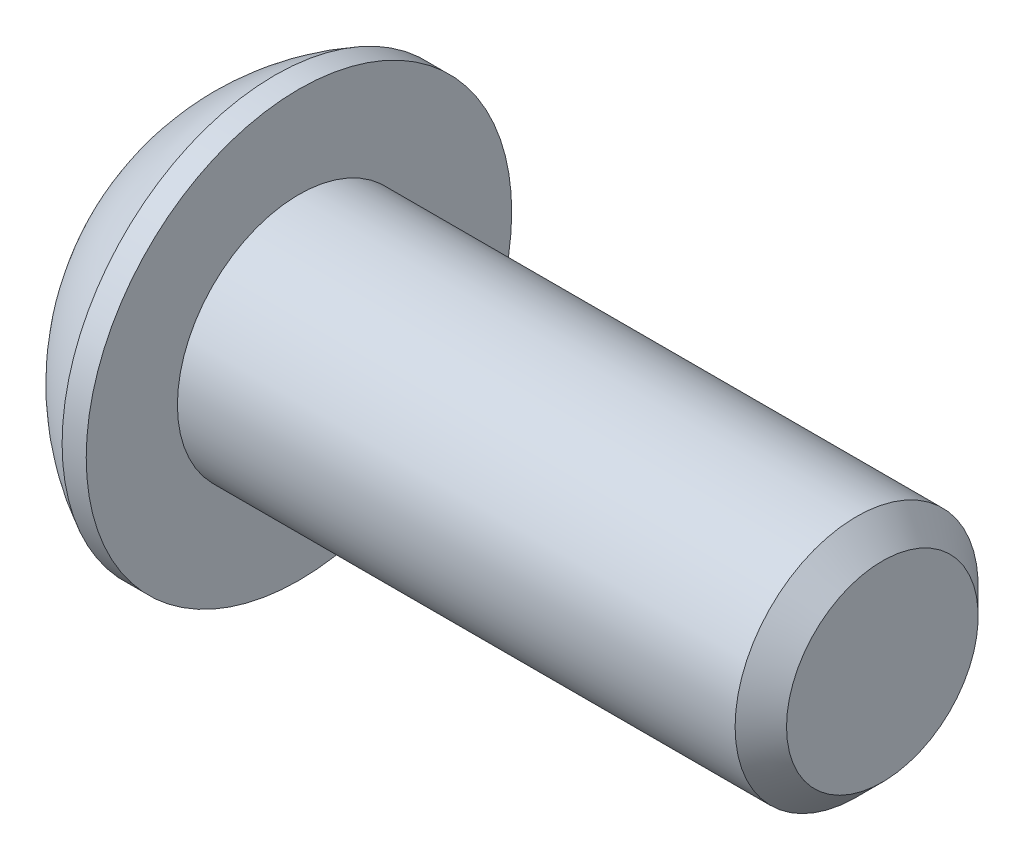
from build123d import *

# Parameters (mm, degrees)
HEX_2_DEPTH = 2.667


with BuildPart() as part:
    # BodySke → BaseBody (revolve)
    with BuildSketch(Plane.XY, mode=Mode.PRIVATE) as basebody_sk:
        with BuildLine():
            Line((23.2664, 0), (23.2664, 3.12928))
            Line((23.2664, 3.12928), (22.42693, 3.96875))
            Line((22.42693, 3.96875), (4.2164, 3.96875))
            Line((4.2164, 3.96875), (4.2164, 6.9469))
            Line((4.2164, 6.9469), (3.429, 6.9469))
            ThreePointArc((3.429, 6.9469), (1.436093175, 5.485019032), (0, 3.47345))
            Line((0, 3.47345), (0, 0))
            Line((0, 0), (23.2664, 0))
        make_face()
    revolve(basebody_sk.sketch.rotate(Axis((0, 0, 0), (1, 0, 0)), 90), axis=Axis((0, 0, 0), (1, 0, 0)))

    # Sketch2 → PreBroach (revolve, cut)
    with BuildSketch(Plane.XY):
        Polygon((0, 2.3876), (2.667, 2.3876), (4.045481503, 0), (0, 0), align=None)
    revolve(axis=Axis((0, 0, 0), (1, 0, 0)), mode=Mode.SUBTRACT)

    # Sketch3 → Hex 2 (cut)
    with BuildSketch(Plane(origin=(0, 0, 0), x_dir=(0, 0, -1), z_dir=(1, 0, 0))):
        Polygon((-2.3876, -1.378481503), (-2.3876, 1.378481503), (0, 2.756963005), (2.3876, 1.378481503), (2.3876, -1.378481503), (0, -2.756963005), align=None)
    extrude(amount=HEX_2_DEPTH, mode=Mode.SUBTRACT)


solid = part.part
